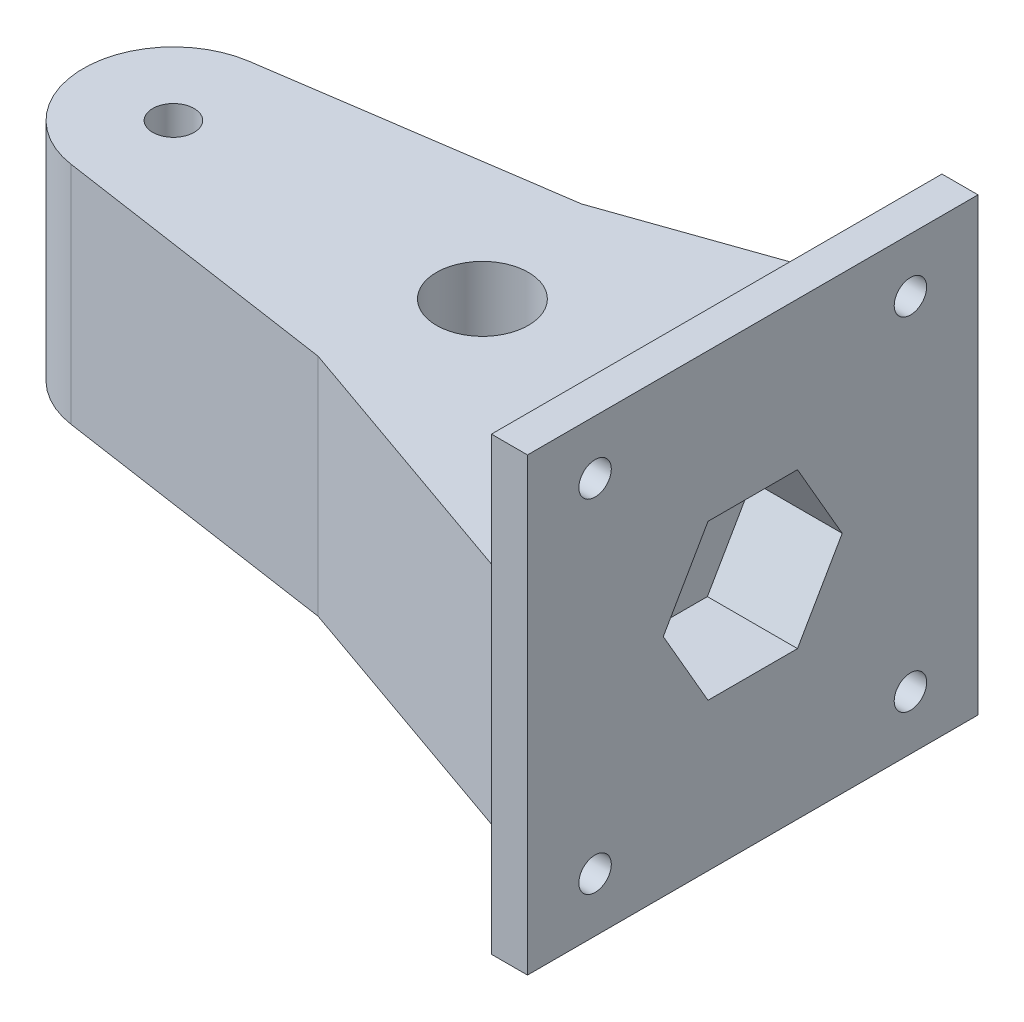
from build123d import *

# Parameters (mm, degrees)
SKETCH1_R               = 5.1
SKETCH1_R_2             = 2.3
BOSS_EXTRUDE1_DEPTH     = 25
SKETCH4_W               = 50
SKETCH4_H               = 12.5
BOSS_EXTRUDE3_DEPTH     = 4
CUT_EXTRUDE3_DEPTH      = 87.900747983
CUT_EXTRUDE3_DEPTH_BACK = 87.900747983
SKETCH5_R               = 1.8
CUT_EXTRUDE4_DEPTH      = 87.900747983
CUT_EXTRUDE4_DEPTH_BACK = 10


with BuildPart() as part:
    # Sketch1 → Boss-Extrude1 (new body)
    with BuildSketch(Plane(origin=(0, 0, 0), x_dir=(1, 0, 0), z_dir=(0, 1, 0))):
        with BuildLine():
            Line((30, 12.5), (30, -12.5))
            Line((30, -12.5), (30, -25))
            Line((30, -25), (26, -25))
            Line((26, -25), (-3.605153395, -14.630751305))
            Line((-3.605153395, -14.630751305), (-35.757725948, -9.893181241))
            ThreePointArc((-35.757725948, -9.893181241), (-44.3, 0), (-35.757725948, 9.893181241))
            Line((-35.757725948, 9.893181241), (-3.605153395, 14.630751305))
            Line((-3.605153395, 14.630751305), (26, 25))
            Line((26, 25), (30, 25))
            Line((30, 25), (30, 12.5))
        make_face()
        with Locations(Location((0, 0, 0), (0, 0, 270))):
            Circle(SKETCH1_R, mode=Mode.SUBTRACT)
        with Locations(Location((-34.3, 0, 0), (0, 0, 270))):
            Circle(SKETCH1_R_2, mode=Mode.SUBTRACT)
    extrude(amount=BOSS_EXTRUDE1_DEPTH)

    # Sketch4 → Boss-Extrude3 (add)
    with BuildSketch(Plane(origin=(30, 0, 0), x_dir=(0, 0, -1), z_dir=(1, 0, 0))):
        with Locations((0, 31.25)):
            Rectangle(SKETCH4_W, SKETCH4_H)
        with Locations((0, -6.25)):
            Rectangle(SKETCH4_W, SKETCH4_H)
    extrude(amount=-BOSS_EXTRUDE3_DEPTH)

    # Sketch5 → Cut-Extrude3 (cut, two sides: drawn at the far end of the back side and taken through both)
    with BuildSketch(Plane(origin=(30, 0, 0), x_dir=(0, 0, -1), z_dir=(1, 0, 0)).offset(-CUT_EXTRUDE3_DEPTH_BACK)):
        with Locations(Location((-17.5, 31.5, 0), (0, 0, 180))):
            Circle(SKETCH5_R)
        with Locations(Location((17.5, 31.5, 0), (0, 0, 180))):
            Circle(SKETCH5_R)
        with Locations(Location((17.5, -6.5, 0), (0, 0, 180))):
            Circle(SKETCH5_R)
        with Locations(Location((-17.5, -6.5, 0), (0, 0, 180))):
            Circle(SKETCH5_R)
    extrude(amount=CUT_EXTRUDE3_DEPTH + CUT_EXTRUDE3_DEPTH_BACK, mode=Mode.SUBTRACT)

    # Sketch3 → Cut-Extrude4 (cut, two sides: drawn at the far end of the back side and taken through both)
    with BuildSketch(Plane(origin=(30, 0, 0), x_dir=(0, 0, -1), z_dir=(1, 0, 0)).offset(-CUT_EXTRUDE4_DEPTH_BACK)):
        Polygon((-4.965212315, 21.1), (-9.93042463, 12.5), (-4.965212315, 3.9), (4.965212315, 3.9), (9.93042463, 12.5), (4.965212315, 21.1), align=None)
    extrude(amount=CUT_EXTRUDE4_DEPTH + CUT_EXTRUDE4_DEPTH_BACK, mode=Mode.SUBTRACT)


solid = part.part
